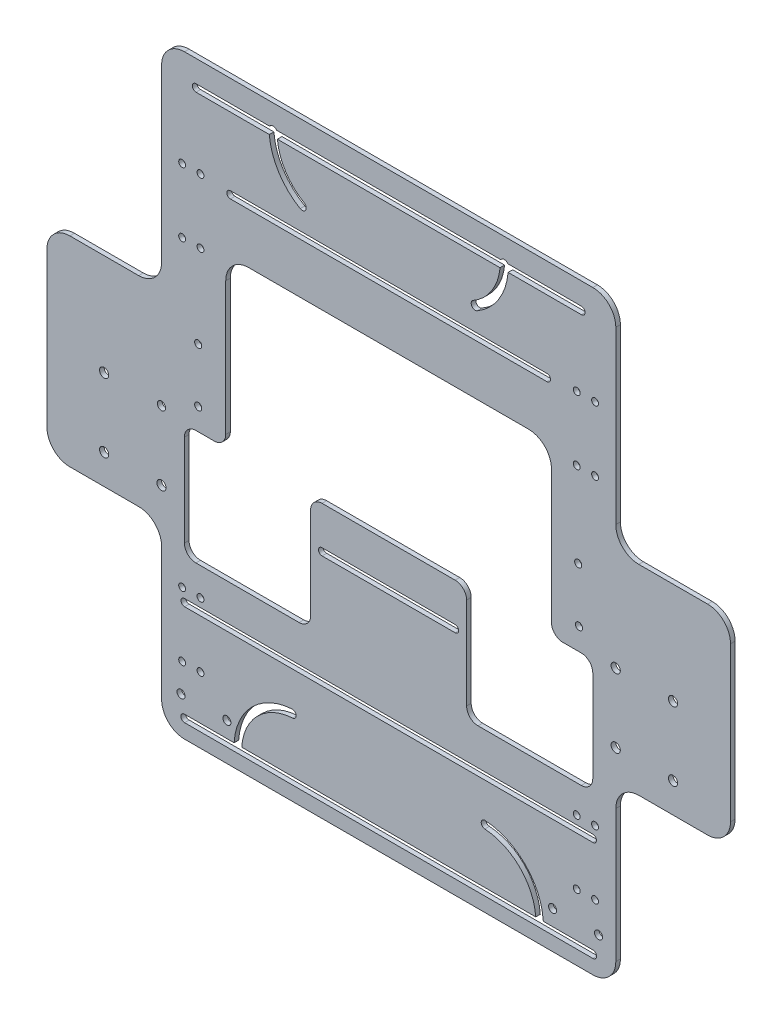
from build123d import *

# Parameters (mm, degrees)
SKETCH_21_W          = 298
SKETCH_21_H          = 198
EXTRUDE_3_DEPTH      = 2
SKETCH_22_W          = 50
SKETCH_22_H          = 53
SKETCH_22_H_2        = 57.8
CUT_EXTRUDE_21_DEPTH = 2
CUT_EXTRUDE_23_DEPTH = 2
FILLET_8_R           = 10
FILLET_10_R          = 5
FILLET_11_R          = 5
FILLET_12_R          = 5
FILLET_13_R          = 5
FILLET_16_R          = 5
FILLET_17_R          = 5
FILLET_18_R          = 5
FILLET_19_R          = 5
FILLET_20_R          = 5
FILLET_21_R          = 5
FILLET_23_R          = 10
FILLET_24_R          = 10
FILLET_25_R          = 10
FILLET_26_R          = 10
FILLET_27_R          = 10
FILLET_28_R          = 10
FILLET_30_R          = 10
SKETCH_27_R          = 1.5
CUT_EXTRUDE_25_DEPTH = 179.902207924
SKETCH_28_W          = 198
SKETCH_28_H          = 2.5
EXTRUDE_4_DEPTH      = 2
SKETCH_32_R          = 2
SKETCH_32_R_2        = 1.8
CUT_EXTRUDE_28_DEPTH = 181.297670534
CUT_EXTRUDE_29_REACH = 182.298
CUT_EXTRUDE_30_REACH = 182.298
CUT_EXTRUDE_31_REACH = 182.298
SKETCH_35_R          = 1.55
CUT_EXTRUDE_33_REACH = 182.298
SKETCH_38_W          = 198
SKETCH_38_H          = 2
EXTRUDE_5_DEPTH      = 20
CUT_EXTRUDE_34_DEPTH = 20
FILLET_31_R          = 10
FILLET_32_R          = 10
CUT_EXTRUDE_START    = -20
SKETCH_41_R          = 1.5
CUT_EXTRUDE_35_DEPTH = 20
SKETCH_42_W          = 198
SKETCH_42_H          = 2
EXTRUDE_6_DEPTH      = 4
SKETCH_44_R          = 1.75
CUT_EXTRUDE_36_DEPTH = 10
SKETCH_45_W          = 198
SKETCH_45_H          = 2
EXTRUDE_7_DEPTH      = 35
SKETCH_46_W          = 142
SKETCH_46_H          = 2
CUT_EXTRUDE_37_DEPTH = 10
FILLET_33_R          = 10
FILLET_34_R          = 10
FILLET_35_R          = 10
FILLET_36_R          = 10
CUT_EXTRUDE_38_DEPTH = 10
CUT_EXTRUDE_39_DEPTH = 10
CUT_EXTRUDE_40_DEPTH = 10


with BuildPart() as part:
    # 草图21 → 凸台-拉伸3 (new body)
    with BuildSketch(Plane.XY):
        Rectangle(SKETCH_21_W, SKETCH_21_H)
    extrude(amount=EXTRUDE_3_DEPTH)

    # 草图22 → 切除-拉伸21 (cut)
    with BuildSketch(Plane(origin=(0, 0, 0), x_dir=(-1, 0, 0), z_dir=(0, 0, -1))):
        with Locations((-124, 72.5)):
            Rectangle(SKETCH_22_W, SKETCH_22_H)
        with Locations((124, 72.5)):
            Rectangle(SKETCH_22_W, SKETCH_22_H)
        with Locations((-124, -70.1)):
            Rectangle(SKETCH_22_W, SKETCH_22_H_2)
        with Locations((124, -70.1)):
            Rectangle(SKETCH_22_W, SKETCH_22_H_2)
    extrude(amount=-CUT_EXTRUDE_21_DEPTH, mode=Mode.SUBTRACT)

    # 草图24 → 切除-拉伸23 (cut)
    with BuildSketch(Plane.XY.offset(2)):
        Polygon((-71.048140698, 63), (70.951859302, 63), (70.951859302, 0), (88.951859302, 0), (88.951859302, -50), (33.951859302, -50), (33.951859302, 0), (-34.048140698, 0), (-34.048140698, -50), (-89.048140698, -50), (-89.048140698, 0), (-71.048140698, 0), align=None)
    extrude(amount=-CUT_EXTRUDE_23_DEPTH, mode=Mode.SUBTRACT)

    # 圆角8
    fillet_8_edges = [part.edges().sort_by_distance(p)[0] for p in [
        (149, -41.2, 1),
    ]]
    fillet(fillet_8_edges, radius=FILLET_8_R)

    # 圆角10
    fillet_10_edges = [part.edges().sort_by_distance(p)[0] for p in [
        (70.951859302, 0, 1),
    ]]
    fillet(fillet_10_edges, radius=FILLET_10_R)

    # 圆角11
    fillet_11_edges = [part.edges().sort_by_distance(p)[0] for p in [
        (33.951859302, 0, 1),
    ]]
    fillet(fillet_11_edges, radius=FILLET_11_R)

    # 圆角12
    fillet_12_edges = [part.edges().sort_by_distance(p)[0] for p in [
        (-34.048140698, 0, 1),
    ]]
    fillet(fillet_12_edges, radius=FILLET_12_R)

    # 圆角13
    fillet_13_edges = [part.edges().sort_by_distance(p)[0] for p in [
        (-71.048140698, 0, 1),
    ]]
    fillet(fillet_13_edges, radius=FILLET_13_R)

    # 圆角16
    fillet_16_edges = [part.edges().sort_by_distance(p)[0] for p in [
        (88.951859302, 0, 1),
    ]]
    fillet(fillet_16_edges, radius=FILLET_16_R)

    # 圆角17
    fillet_17_edges = [part.edges().sort_by_distance(p)[0] for p in [
        (88.951859302, -50, 1),
    ]]
    fillet(fillet_17_edges, radius=FILLET_17_R)

    # 圆角18
    fillet_18_edges = [part.edges().sort_by_distance(p)[0] for p in [
        (33.951859302, -50, 1),
    ]]
    fillet(fillet_18_edges, radius=FILLET_18_R)

    # 圆角19
    fillet_19_edges = [part.edges().sort_by_distance(p)[0] for p in [
        (-34.048140698, -50, 1),
    ]]
    fillet(fillet_19_edges, radius=FILLET_19_R)

    # 圆角20
    fillet_20_edges = [part.edges().sort_by_distance(p)[0] for p in [
        (-89.048140698, -50, 1),
    ]]
    fillet(fillet_20_edges, radius=FILLET_20_R)

    # 圆角21
    fillet_21_edges = [part.edges().sort_by_distance(p)[0] for p in [
        (-89.048140698, 0, 1),
    ]]
    fillet(fillet_21_edges, radius=FILLET_21_R)

    # 圆角23
    fillet_23_edges = [part.edges().sort_by_distance(p)[0] for p in [
        (99, 46, 1),
    ]]
    fillet(fillet_23_edges, radius=FILLET_23_R)

    # 圆角24
    fillet_24_edges = [part.edges().sort_by_distance(p)[0] for p in [
        (149, 46, 1),
    ]]
    fillet(fillet_24_edges, radius=FILLET_24_R)

    # 圆角25
    fillet_25_edges = [part.edges().sort_by_distance(p)[0] for p in [
        (-99, 46, 1),
    ]]
    fillet(fillet_25_edges, radius=FILLET_25_R)

    # 圆角26
    fillet_26_edges = [part.edges().sort_by_distance(p)[0] for p in [
        (-149, 46, 1),
    ]]
    fillet(fillet_26_edges, radius=FILLET_26_R)

    # 圆角27
    fillet_27_edges = [part.edges().sort_by_distance(p)[0] for p in [
        (-149, -41.2, 1),
    ]]
    fillet(fillet_27_edges, radius=FILLET_27_R)

    # 圆角28
    fillet_28_edges = [part.edges().sort_by_distance(p)[0] for p in [
        (99, -41.2, 1),
    ]]
    fillet(fillet_28_edges, radius=FILLET_28_R)

    # 圆角30
    fillet_30_edges = [part.edges().sort_by_distance(p)[0] for p in [
        (-99, -41.2, 1),
    ]]
    fillet(fillet_30_edges, radius=FILLET_30_R)

    # 草图27 → 切除-拉伸25 (cut, through all)
    with BuildSketch(Plane(origin=(0, 0, 0), x_dir=(-1, 0, 0), z_dir=(0, 0, -1))):
        with Locations((-89.951859302, 97.817904944)):
            Circle(SKETCH_27_R)
        with Locations((-81.951859302, 97.817904944)):
            Circle(SKETCH_27_R)
        with Locations((-89.951859302, 69.817904944)):
            Circle(SKETCH_27_R)
        with Locations((-81.951859302, 69.817904944)):
            Circle(SKETCH_27_R)
        with Locations((82.048140698, 97.817904944)):
            Circle(SKETCH_27_R)
        with Locations((90.048140698, 97.817904944)):
            Circle(SKETCH_27_R)
        with Locations((82.048140698, 69.817904944)):
            Circle(SKETCH_27_R)
        with Locations((90.048140698, 69.817904944)):
            Circle(SKETCH_27_R)
        with Locations((-89.951859302, -62.182095056)):
            Circle(SKETCH_27_R)
        with Locations((-81.951859302, -62.182095056)):
            Circle(SKETCH_27_R)
        with Locations((-89.951859302, -90.182095056)):
            Circle(SKETCH_27_R)
        with Locations((-81.951859302, -90.182095056)):
            Circle(SKETCH_27_R)
        with Locations((82.048140698, -62.182095056)):
            Circle(SKETCH_27_R)
        with Locations((90.048140698, -62.182095056)):
            Circle(SKETCH_27_R)
        with Locations((82.048140698, -90.182095056)):
            Circle(SKETCH_27_R)
        with Locations((90.048140698, -90.182095056)):
            Circle(SKETCH_27_R)
    extrude(amount=-CUT_EXTRUDE_25_DEPTH, mode=Mode.SUBTRACT)

    # 草图28 → 凸台-拉伸4 (add)
    with BuildSketch(Plane.XY.offset(2)):
        with Locations((0, 100.25)):
            Rectangle(SKETCH_28_W, SKETCH_28_H)
    extrude(amount=-EXTRUDE_4_DEPTH)

    # 草图32 → 切除-拉伸28 (cut, through all)
    with BuildSketch(Plane.XY.offset(2)):
        with Locations((-124.048140698, 1.8)):
            Circle(SKETCH_32_R)
        with Locations((-99.048140698, 1.8)):
            Circle(SKETCH_32_R_2)
        with Locations((-124.048140698, -28.2)):
            Circle(SKETCH_32_R)
        with Locations((-99.048140698, -28.2)):
            Circle(SKETCH_32_R)
        with Locations((98.951859302, 1.8)):
            Circle(SKETCH_32_R)
        with Locations((98.951859302, -28.2)):
            Circle(SKETCH_32_R)
        with Locations((123.951859302, -28.2)):
            Circle(SKETCH_32_R)
        with Locations((123.951859302, 1.8)):
            Circle(SKETCH_32_R)
    extrude(amount=-CUT_EXTRUDE_28_DEPTH, mode=Mode.SUBTRACT)

    # 草图33 → 切除-拉伸29 (cut, up to next)
    with BuildSketch(Plane.XY.offset(2), mode=Mode.PRIVATE) as cut_extrude_29_sk1:
        with BuildLine():
            Line((-89, -65.9), (89, -65.9))
            ThreePointArc((89, -65.9), (90.55, -67.45), (89, -69))
            Line((89, -69), (-89, -69))
            ThreePointArc((-89, -69), (-90.55, -67.45), (-89, -65.9))
        make_face()
    cut_extrude_29_tool1 = extrude(cut_extrude_29_sk1.sketch, amount=-CUT_EXTRUDE_29_REACH, mode=Mode.PRIVATE) & part.part
    add(cut_extrude_29_tool1.solids().sort_by_distance((0, -67.45, 2))[0], mode=Mode.SUBTRACT)

    # 草图34 → 切除-拉伸30 (cut, up to next)
    with BuildSketch(Plane.XY.offset(2), mode=Mode.PRIVATE) as cut_extrude_30_sk1:
        with BuildLine():
            Line((-29.048140698, -16.755), (28.951859302, -16.755))
            ThreePointArc((28.951859302, -16.755), (30.501859302, -18.305), (28.951859302, -19.855))
            Line((28.951859302, -19.855), (-29.048140698, -19.855))
            ThreePointArc((-29.048140698, -19.855), (-30.598140698, -18.305), (-29.048140698, -16.755))
        make_face()
    cut_extrude_30_tool1 = extrude(cut_extrude_30_sk1.sketch, amount=-CUT_EXTRUDE_30_REACH, mode=Mode.PRIVATE) & part.part
    add(cut_extrude_30_tool1.solids().sort_by_distance((-0.048141, -18.305, 2))[0], mode=Mode.SUBTRACT)

    # 草图35 → 切除-拉伸31 (cut, up to next)
    with BuildSketch(Plane.XY.offset(2), mode=Mode.PRIVATE) as cut_extrude_31_sk1:
        with Locations((-83.048140698, 33.123295517)):
            Circle(SKETCH_35_R)
    cut_extrude_31_tool1 = extrude(cut_extrude_31_sk1.sketch, amount=-CUT_EXTRUDE_31_REACH, mode=Mode.PRIVATE) & part.part
    # 草图35 → 切除-拉伸31 (cut, up to next)
    with BuildSketch(Plane.XY.offset(2), mode=Mode.PRIVATE) as cut_extrude_31_sk2:
        with Locations((-83.048140698, 9.574778632)):
            Circle(SKETCH_35_R)
    cut_extrude_31_tool2 = extrude(cut_extrude_31_sk2.sketch, amount=-CUT_EXTRUDE_31_REACH, mode=Mode.PRIVATE) & part.part
    # 草图35 → 切除-拉伸31 (cut, up to next)
    with BuildSketch(Plane.XY.offset(2), mode=Mode.PRIVATE) as cut_extrude_31_sk3:
        with Locations((82.599823082, 33.123295517)):
            Circle(SKETCH_35_R)
    cut_extrude_31_tool3 = extrude(cut_extrude_31_sk3.sketch, amount=-CUT_EXTRUDE_31_REACH, mode=Mode.PRIVATE) & part.part
    # 草图35 → 切除-拉伸31 (cut, up to next)
    with BuildSketch(Plane.XY.offset(2), mode=Mode.PRIVATE) as cut_extrude_31_sk4:
        with Locations((82.951859302, 9.574778632)):
            Circle(SKETCH_35_R)
    cut_extrude_31_tool4 = extrude(cut_extrude_31_sk4.sketch, amount=-CUT_EXTRUDE_31_REACH, mode=Mode.PRIVATE) & part.part
    add(cut_extrude_31_tool1.solids().sort_by_distance((-83.048141, 33.123296, 2))[0], mode=Mode.SUBTRACT)
    add(cut_extrude_31_tool2.solids().sort_by_distance((-83.048141, 9.574779, 2))[0], mode=Mode.SUBTRACT)
    add(cut_extrude_31_tool3.solids().sort_by_distance((82.599823, 33.123296, 2))[0], mode=Mode.SUBTRACT)
    add(cut_extrude_31_tool4.solids().sort_by_distance((82.951859, 9.574779, 2))[0], mode=Mode.SUBTRACT)

    # 草图37 → 切除-拉伸33 (cut, up to next)
    with BuildSketch(Plane.XY.offset(2), mode=Mode.PRIVATE) as cut_extrude_33_sk1:
        with BuildLine():
            Line((-69, 98.05), (69, 98.05))
            ThreePointArc((69, 98.05), (70.55, 96.5), (69, 94.95))
            Line((69, 94.95), (-69, 94.95))
            ThreePointArc((-69, 94.95), (-70.55, 96.5), (-69, 98.05))
        make_face()
    cut_extrude_33_tool1 = extrude(cut_extrude_33_sk1.sketch, amount=-CUT_EXTRUDE_33_REACH, mode=Mode.PRIVATE) & part.part
    add(cut_extrude_33_tool1.solids().sort_by_distance((0, 96.5, 2))[0], mode=Mode.SUBTRACT)

    # 草图38 → 凸台-拉伸5 (add)
    with BuildSketch(Plane.XZ.offset(99)):
        with Locations((0, 1)):
            Rectangle(SKETCH_38_W, SKETCH_38_H)
    extrude(amount=EXTRUDE_5_DEPTH)

    # 草图39 → 切除-拉伸34 (cut)
    with BuildSketch(Plane(origin=(0, 0, 0), x_dir=(-1, 0, 0), z_dir=(0, 0, -1))):
        with BuildLine():
            Line((-89, -109.582095056), (89, -109.582095056))
            ThreePointArc((89, -109.582095056), (90.6, -111.182095056), (89, -112.782095056))
            Line((89, -112.782095056), (-89, -112.782095056))
            ThreePointArc((-89, -112.782095056), (-90.6, -111.182095056), (-89, -109.582095056))
        make_face()
    extrude(amount=-CUT_EXTRUDE_34_DEPTH, mode=Mode.SUBTRACT)

    # 圆角31
    fillet_31_edges = [part.edges().sort_by_distance(p)[0] for p in [
        (99, -119, 1),
    ]]
    fillet(fillet_31_edges, radius=FILLET_31_R)

    # 圆角32
    fillet_32_edges = [part.edges().sort_by_distance(p)[0] for p in [
        (-99, -119, 1),
    ]]
    fillet(fillet_32_edges, radius=FILLET_32_R)

    # 草图41 → 切除-拉伸35 (cut)
    with BuildSketch(Plane.XY.offset(2).offset(CUT_EXTRUDE_START)):
        with Locations(Location((-90.048140698, 97.817904944, 0), (0, 0, 180))):
            Circle(SKETCH_41_R)
        with Locations(Location((-82.048140698, 97.817904944, 0), (0, 0, 180))):
            Circle(SKETCH_41_R)
        with Locations(Location((81.951859302, 97.817904944, 0), (0, 0, 180))):
            Circle(SKETCH_41_R)
        with Locations(Location((89.951859302, 97.817904944, 0), (0, 0, 180))):
            Circle(SKETCH_41_R)
    extrude(amount=CUT_EXTRUDE_35_DEPTH, mode=Mode.SUBTRACT)

    # 草图42 → 凸台-拉伸6 (add)
    with BuildSketch(Plane(origin=(0, 101.5, 0), x_dir=(1, 0, 0), z_dir=(0, 1, 0))):
        with Locations((0, -1)):
            Rectangle(SKETCH_42_W, SKETCH_42_H)
    extrude(amount=EXTRUDE_6_DEPTH)

    # 草图44 → 切除-拉伸36 (cut)
    with BuildSketch(Plane(origin=(0, 0, 0), x_dir=(-1, 0, 0), z_dir=(0, 0, -1))):
        with Locations((90.532208217, -102.687622738)):
            Circle(SKETCH_44_R)
        with Locations((70.532208217, -102.687622738)):
            Circle(SKETCH_44_R)
        with Locations((-71.467791783, -102.687622738)):
            Circle(SKETCH_44_R)
        with Locations((-91.467791783, -102.687622738)):
            Circle(SKETCH_44_R)
    extrude(amount=-CUT_EXTRUDE_36_DEPTH, mode=Mode.SUBTRACT)

    # 草图45 → 凸台-拉伸7 (add)
    with BuildSketch(Plane(origin=(0, 105.5, 0), x_dir=(1, 0, 0), z_dir=(0, 1, 0))):
        with Locations((0, -1)):
            Rectangle(SKETCH_45_W, SKETCH_45_H)
    extrude(amount=EXTRUDE_7_DEPTH)

    # 草图46 → 切除-拉伸37 (cut)
    with BuildSketch(Plane.XZ.offset(-63)):
        with Locations((-0.048140698, 1)):
            Rectangle(SKETCH_46_W, SKETCH_46_H)
    extrude(amount=-CUT_EXTRUDE_37_DEPTH, mode=Mode.SUBTRACT)

    # 圆角33
    fillet_33_edges = [part.edges().sort_by_distance(p)[0] for p in [
        (70.951859302, 73, 1),
    ]]
    fillet(fillet_33_edges, radius=FILLET_33_R)

    # 圆角34
    fillet_34_edges = [part.edges().sort_by_distance(p)[0] for p in [
        (-71.048140698, 73, 1),
    ]]
    fillet(fillet_34_edges, radius=FILLET_34_R)

    # 圆角35
    fillet_35_edges = [part.edges().sort_by_distance(p)[0] for p in [
        (99, 140.5, 1),
    ]]
    fillet(fillet_35_edges, radius=FILLET_35_R)

    # 圆角36
    fillet_36_edges = [part.edges().sort_by_distance(p)[0] for p in [
        (-99, 140.5, 1),
    ]]
    fillet(fillet_36_edges, radius=FILLET_36_R)

    # 草图47 → 切除-拉伸38 (cut)
    with BuildSketch(Plane(origin=(0, 0, 0), x_dir=(-1, 0, 0), z_dir=(0, 0, -1))):
        with BuildLine():
            Line((-84, 130.939510991), (84, 130.939510991))
            ThreePointArc((84, 130.939510991), (85.6, 129.339510991), (84, 127.739510991))
            Line((84, 127.739510991), (-84, 127.739510991))
            ThreePointArc((-84, 127.739510991), (-85.6, 129.339510991), (-84, 130.939510991))
        make_face()
    extrude(amount=-CUT_EXTRUDE_38_DEPTH, mode=Mode.SUBTRACT)

    # 草图48 → 切除-拉伸39 (cut)
    with BuildSketch(Plane.XY.offset(2)):
        with BuildLine():
            ThreePointArc((38.575, 106.510975229), (48.512589713, 116.448564942), (52.15, 130.023564942))
            ThreePointArc((52.15, 130.023564942), (50.4, 131.773564942), (48.65, 130.023564942))
            ThreePointArc((48.65, 130.023564942), (45.4815008, 118.198564942), (36.825, 109.542064143))
            ThreePointArc((36.825, 109.542064143), (36.184455543, 107.151519686), (38.575, 106.510975229))
        make_face()
        with BuildLine():
            ThreePointArc((-38.575, 106.510975229), (-48.512589713, 116.448564942), (-52.15, 130.023564942))
            ThreePointArc((-52.15, 130.023564942), (-50.4, 131.773564942), (-48.65, 130.023564942))
            ThreePointArc((-48.65, 130.023564942), (-45.4815008, 118.198564942), (-36.825, 109.542064143))
            ThreePointArc((-36.825, 109.542064143), (-36.184455543, 107.151519686), (-38.575, 106.510975229))
        make_face()
    extrude(amount=-CUT_EXTRUDE_39_DEPTH, mode=Mode.SUBTRACT)

    # 草图49 → 切除-拉伸40 (cut)
    with BuildSketch(Plane.XY.offset(2)):
        with BuildLine():
            ThreePointArc((67.384399899, -109.478158048), (59.512110152, -92.051608348), (42.082887412, -84.185238475))
            ThreePointArc((42.082887412, -84.185238475), (40.332751416, -85.728619178), (41.87613212, -87.478755174))
            ThreePointArc((41.87613212, -87.478755174), (57.179054119, -94.385457004), (64.09095362, -109.686032064))
            ThreePointArc((64.09095362, -109.686032064), (65.841613767, -111.228818196), (67.384399899, -109.478158048))
        make_face()
        with BuildLine():
            ThreePointArc((-67.384399899, -109.478158048), (-59.512110152, -92.051608348), (-42.082887412, -84.185238475))
            ThreePointArc((-42.082887412, -84.185238475), (-40.332751416, -85.728619178), (-41.87613212, -87.478755174))
            ThreePointArc((-41.87613212, -87.478755174), (-57.179054119, -94.385457004), (-64.09095362, -109.686032064))
            ThreePointArc((-64.09095362, -109.686032064), (-65.841613767, -111.228818196), (-67.384399899, -109.478158048))
        make_face()
    extrude(amount=-CUT_EXTRUDE_40_DEPTH, mode=Mode.SUBTRACT)


solid = part.part
